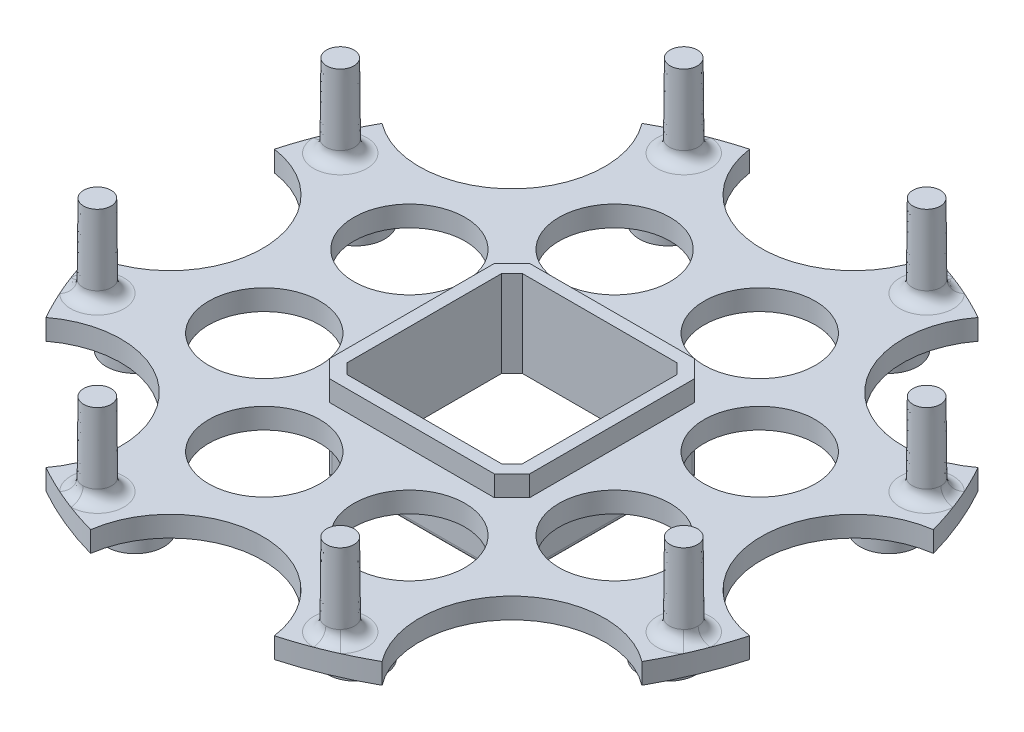
from build123d import *

# Parameters (mm, degrees)
SKETCH1_R                     = 83
BOSS_EXTRUDE1_DEPTH           = 5
SKETCH3_R                     = 3.5
BOSS_EXTRUDE2_DEPTH           = 20
BOSS_EXTRUDE2_DRAFT           = 0.5
BOSS_EXTRUDE2_PROFILE_2_DEPTH = 20
BOSS_EXTRUDE2_PROFILE_2_DRAFT = 0.5
BOSS_EXTRUDE2_PROFILE_3_DEPTH = 20
BOSS_EXTRUDE2_PROFILE_3_DRAFT = 0.5
BOSS_EXTRUDE2_PROFILE_4_DEPTH = 20
BOSS_EXTRUDE2_PROFILE_4_DRAFT = 0.5
BOSS_EXTRUDE2_PROFILE_5_DEPTH = 20
BOSS_EXTRUDE2_PROFILE_5_DRAFT = 0.5
BOSS_EXTRUDE2_PROFILE_6_DEPTH = 20
BOSS_EXTRUDE2_PROFILE_6_DRAFT = 0.5
BOSS_EXTRUDE2_PROFILE_7_DEPTH = 20
BOSS_EXTRUDE2_PROFILE_7_DRAFT = 0.5
BOSS_EXTRUDE2_PROFILE_8_DEPTH = 20
BOSS_EXTRUDE2_PROFILE_8_DRAFT = 0.5
SKETCH4_W                     = 42.5
SKETCH4_H                     = 42.5
CUT_EXTRUDE1_DEPTH            = 121.012499349
SKETCH5_R                     = 22.5
SKETCH5_R_2                   = 13.5
CUT_EXTRUDE2_DEPTH            = 121.012499349
FILLET1_R                     = 3
CHAMFER1_SIZE                 = 2.5
SKETCH7_R                     = 7
SKETCH7_R_2                   = 2.15
BOSS_EXTRUDE3_DEPTH           = 5
EXTRUDE_THIN1_DEPTH           = 11
EXTRUDE_THIN1_DEPTH_BACK      = 10
FILLET3_R                     = 1.25


with BuildPart() as part:
    # Sketch1 → Boss-Extrude1 (new body)
    with BuildSketch(Plane(origin=(0, 0, 0), x_dir=(1, 0, 0), z_dir=(0, 1, 0))):
        with Locations(Location((0, 0, 0), (0, 0, 270))):
            Circle(SKETCH1_R)
    extrude(amount=BOSS_EXTRUDE1_DEPTH)


with BuildPart() as boss_extrude2_tool:
    # Sketch3 → Boss-Extrude2 (with draft: the straight prism first)
    with BuildSketch(Plane(origin=(0, 5, 0), x_dir=(1, 0, 0), z_dir=(0, 1, 0))):
        with Locations((-71.138724003, 29.466624292)):
            Circle(SKETCH3_R)
    extrude(amount=BOSS_EXTRUDE2_DEPTH)
    # Boss-Extrude2: the draft: its side faces are tilted about the plane it starts from
    boss_extrude2_sides = [boss_extrude2_tool.faces().sort_by_distance(p)[0] for p in [
        (-74.638724003, 15, -29.466624292),
    ]]
    draft(boss_extrude2_sides, Plane(origin=(0, 5, 0), x_dir=(1, 0, 0), z_dir=(0, 1, 0)), BOSS_EXTRUDE2_DRAFT)


with BuildPart() as part_1:
    add(part.part)

    # Boss-Extrude2: add boss_extrude2_tool
    add(boss_extrude2_tool.part)


with BuildPart() as boss_extrude2_profile_2_tool:
    # Sketch3 → Boss-Extrude2 profile 2 (with draft: the straight prism first)
    with BuildSketch(Plane(origin=(0, 5, 0), x_dir=(1, 0, 0), z_dir=(0, 1, 0))):
        with Locations((-29.466624292, 71.138724003)):
            Circle(SKETCH3_R)
    extrude(amount=BOSS_EXTRUDE2_PROFILE_2_DEPTH)
    # Boss-Extrude2 profile 2: the draft: its side faces are tilted about the plane it starts from
    boss_extrude2_profile_2_sides = [boss_extrude2_profile_2_tool.faces().sort_by_distance(p)[0] for p in [
        (-32.966624292, 15, -71.138724003),
    ]]
    draft(boss_extrude2_profile_2_sides, Plane(origin=(0, 5, 0), x_dir=(1, 0, 0), z_dir=(0, 1, 0)), BOSS_EXTRUDE2_PROFILE_2_DRAFT)


with BuildPart() as part_2:
    add(part_1.part)

    # Boss-Extrude2 profile 2: add boss_extrude2_profile_2_tool
    add(boss_extrude2_profile_2_tool.part)


with BuildPart() as boss_extrude2_profile_3_tool:
    # Sketch3 → Boss-Extrude2 profile 3 (with draft: the straight prism first)
    with BuildSketch(Plane(origin=(0, 5, 0), x_dir=(1, 0, 0), z_dir=(0, 1, 0))):
        with Locations((29.466624292, 71.138724003)):
            Circle(SKETCH3_R)
    extrude(amount=BOSS_EXTRUDE2_PROFILE_3_DEPTH)
    # Boss-Extrude2 profile 3: the draft: its side faces are tilted about the plane it starts from
    boss_extrude2_profile_3_sides = [boss_extrude2_profile_3_tool.faces().sort_by_distance(p)[0] for p in [
        (25.966624292, 15, -71.138724003),
    ]]
    draft(boss_extrude2_profile_3_sides, Plane(origin=(0, 5, 0), x_dir=(1, 0, 0), z_dir=(0, 1, 0)), BOSS_EXTRUDE2_PROFILE_3_DRAFT)


with BuildPart() as part_3:
    add(part_2.part)

    # Boss-Extrude2 profile 3: add boss_extrude2_profile_3_tool
    add(boss_extrude2_profile_3_tool.part)


with BuildPart() as boss_extrude2_profile_4_tool:
    # Sketch3 → Boss-Extrude2 profile 4 (with draft: the straight prism first)
    with BuildSketch(Plane(origin=(0, 5, 0), x_dir=(1, 0, 0), z_dir=(0, 1, 0))):
        with Locations((71.138724003, 29.466624292)):
            Circle(SKETCH3_R)
    extrude(amount=BOSS_EXTRUDE2_PROFILE_4_DEPTH)
    # Boss-Extrude2 profile 4: the draft: its side faces are tilted about the plane it starts from
    boss_extrude2_profile_4_sides = [boss_extrude2_profile_4_tool.faces().sort_by_distance(p)[0] for p in [
        (67.638724003, 15, -29.466624292),
    ]]
    draft(boss_extrude2_profile_4_sides, Plane(origin=(0, 5, 0), x_dir=(1, 0, 0), z_dir=(0, 1, 0)), BOSS_EXTRUDE2_PROFILE_4_DRAFT)


with BuildPart() as part_4:
    add(part_3.part)

    # Boss-Extrude2 profile 4: add boss_extrude2_profile_4_tool
    add(boss_extrude2_profile_4_tool.part)


with BuildPart() as boss_extrude2_profile_5_tool:
    # Sketch3 → Boss-Extrude2 profile 5 (with draft: the straight prism first)
    with BuildSketch(Plane(origin=(0, 5, 0), x_dir=(1, 0, 0), z_dir=(0, 1, 0))):
        with Locations((71.138724003, -29.466624292)):
            Circle(SKETCH3_R)
    extrude(amount=BOSS_EXTRUDE2_PROFILE_5_DEPTH)
    # Boss-Extrude2 profile 5: the draft: its side faces are tilted about the plane it starts from
    boss_extrude2_profile_5_sides = [boss_extrude2_profile_5_tool.faces().sort_by_distance(p)[0] for p in [
        (67.638724003, 15, 29.466624292),
    ]]
    draft(boss_extrude2_profile_5_sides, Plane(origin=(0, 5, 0), x_dir=(1, 0, 0), z_dir=(0, 1, 0)), BOSS_EXTRUDE2_PROFILE_5_DRAFT)


with BuildPart() as part_5:
    add(part_4.part)

    # Boss-Extrude2 profile 5: add boss_extrude2_profile_5_tool
    add(boss_extrude2_profile_5_tool.part)


with BuildPart() as boss_extrude2_profile_6_tool:
    # Sketch3 → Boss-Extrude2 profile 6 (with draft: the straight prism first)
    with BuildSketch(Plane(origin=(0, 5, 0), x_dir=(1, 0, 0), z_dir=(0, 1, 0))):
        with Locations((29.466624292, -71.138724003)):
            Circle(SKETCH3_R)
    extrude(amount=BOSS_EXTRUDE2_PROFILE_6_DEPTH)
    # Boss-Extrude2 profile 6: the draft: its side faces are tilted about the plane it starts from
    boss_extrude2_profile_6_sides = [boss_extrude2_profile_6_tool.faces().sort_by_distance(p)[0] for p in [
        (25.966624292, 15, 71.138724003),
    ]]
    draft(boss_extrude2_profile_6_sides, Plane(origin=(0, 5, 0), x_dir=(1, 0, 0), z_dir=(0, 1, 0)), BOSS_EXTRUDE2_PROFILE_6_DRAFT)


with BuildPart() as part_6:
    add(part_5.part)

    # Boss-Extrude2 profile 6: add boss_extrude2_profile_6_tool
    add(boss_extrude2_profile_6_tool.part)


with BuildPart() as boss_extrude2_profile_7_tool:
    # Sketch3 → Boss-Extrude2 profile 7 (with draft: the straight prism first)
    with BuildSketch(Plane(origin=(0, 5, 0), x_dir=(1, 0, 0), z_dir=(0, 1, 0))):
        with Locations((-29.466624292, -71.138724003)):
            Circle(SKETCH3_R)
    extrude(amount=BOSS_EXTRUDE2_PROFILE_7_DEPTH)
    # Boss-Extrude2 profile 7: the draft: its side faces are tilted about the plane it starts from
    boss_extrude2_profile_7_sides = [boss_extrude2_profile_7_tool.faces().sort_by_distance(p)[0] for p in [
        (-32.966624292, 15, 71.138724003),
    ]]
    draft(boss_extrude2_profile_7_sides, Plane(origin=(0, 5, 0), x_dir=(1, 0, 0), z_dir=(0, 1, 0)), BOSS_EXTRUDE2_PROFILE_7_DRAFT)


with BuildPart() as part_7:
    add(part_6.part)

    # Boss-Extrude2 profile 7: add boss_extrude2_profile_7_tool
    add(boss_extrude2_profile_7_tool.part)


with BuildPart() as boss_extrude2_profile_8_tool:
    # Sketch3 → Boss-Extrude2 profile 8 (with draft: the straight prism first)
    with BuildSketch(Plane(origin=(0, 5, 0), x_dir=(1, 0, 0), z_dir=(0, 1, 0))):
        with Locations((-71.138724003, -29.466624292)):
            Circle(SKETCH3_R)
    extrude(amount=BOSS_EXTRUDE2_PROFILE_8_DEPTH)
    # Boss-Extrude2 profile 8: the draft: its side faces are tilted about the plane it starts from
    boss_extrude2_profile_8_sides = [boss_extrude2_profile_8_tool.faces().sort_by_distance(p)[0] for p in [
        (-74.638724003, 15, 29.466624292),
    ]]
    draft(boss_extrude2_profile_8_sides, Plane(origin=(0, 5, 0), x_dir=(1, 0, 0), z_dir=(0, 1, 0)), BOSS_EXTRUDE2_PROFILE_8_DRAFT)


with BuildPart() as part_8:
    add(part_7.part)

    # Boss-Extrude2 profile 8: add boss_extrude2_profile_8_tool
    add(boss_extrude2_profile_8_tool.part)

    # Sketch4 → Cut-Extrude1 (cut, through all)
    with BuildSketch(Plane.XZ):
        Rectangle(SKETCH4_W, SKETCH4_H)
    extrude(amount=-CUT_EXTRUDE1_DEPTH, mode=Mode.SUBTRACT)

    # Sketch5 → Cut-Extrude2 (cut, through all)
    with BuildSketch(Plane.XZ):
        with Locations((-83, 0)):
            Circle(SKETCH5_R)
        with Locations((-58.689862838, 58.689862838)):
            Circle(SKETCH5_R)
        with Locations((0, 83)):
            Circle(SKETCH5_R)
        with Locations((58.689862838, 58.689862838)):
            Circle(SKETCH5_R)
        with Locations((83, 0)):
            Circle(SKETCH5_R)
        with Locations((58.689862838, -58.689862838)):
            Circle(SKETCH5_R)
        with Locations((0, -83)):
            Circle(SKETCH5_R)
        with Locations((-58.689862838, -58.689862838)):
            Circle(SKETCH5_R)
        with Locations(Location((17.603437889, 42.498458496, 0), (0, 0, 270))):
            Circle(SKETCH5_R_2)
        with Locations(Location((42.498458496, 17.603437889, 0), (0, 0, 270))):
            Circle(SKETCH5_R_2)
        with Locations(Location((42.498458496, -17.603437889, 0), (0, 0, 270))):
            Circle(SKETCH5_R_2)
        with Locations(Location((17.603437889, -42.498458496, 0), (0, 0, 270))):
            Circle(SKETCH5_R_2)
        with Locations(Location((-17.603437889, -42.498458496, 0), (0, 0, 270))):
            Circle(SKETCH5_R_2)
        with Locations(Location((-42.498458496, -17.603437889, 0), (0, 0, 270))):
            Circle(SKETCH5_R_2)
        with Locations(Location((-42.498458496, 17.603437889, 0), (0, 0, 270))):
            Circle(SKETCH5_R_2)
        with Locations(Location((-17.603437889, 42.498458496, 0), (0, 0, 270))):
            Circle(SKETCH5_R_2)
    extrude(amount=-CUT_EXTRUDE2_DEPTH, mode=Mode.SUBTRACT)

    # Fillet1
    fillet1_edges = [part_8.edges().sort_by_distance(p)[0] for p in [
        (-32.966624292, 5, -71.138724003),
        (-74.638724003, 5, -29.466624292),
        (-74.638724003, 5, 29.466624292),
        (-32.966624292, 5, 71.138724003),
        (25.966624292, 5, 71.138724003),
        (67.638724003, 5, 29.466624292),
        (67.638724003, 5, -29.466624292),
        (25.966624292, 5, -71.138724003),
    ]]
    fillet(fillet1_edges, radius=FILLET1_R)

    # Chamfer1
    chamfer1_edges = [part_8.edges().sort_by_distance(p)[0] for p in [
        (-21.25, 2.5, -21.25),
        (-21.25, 2.5, 21.25),
        (21.25, 2.5, 21.25),
        (21.25, 2.5, -21.25),
    ]]
    chamfer(chamfer1_edges, length=CHAMFER1_SIZE)

    # Sketch7 → Boss-Extrude3 (add)
    # profile 1 of 8: a face of its own
    with BuildSketch(Plane(origin=(0, 0, 0), x_dir=(-1, 0, 0), z_dir=(0, -1, 0))):
        with Locations(Location((-64.671567276, 26.787840266, 0), (0, 0, 270))):
            Circle(SKETCH7_R)
        with Locations(Location((-64.671567276, 26.787840266, 0), (0, 0, 90))):
            Circle(SKETCH7_R_2, mode=Mode.SUBTRACT)
    # profile 2 of 8: a face of its own
    with BuildSketch(Plane(origin=(0, 0, 0), x_dir=(-1, 0, 0), z_dir=(0, -1, 0))):
        with Locations(Location((-26.787840266, -64.671567276, 0), (0, 0, 270))):
            Circle(SKETCH7_R)
        with Locations(Location((-26.787840266, -64.671567276, 0), (0, 0, 90))):
            Circle(SKETCH7_R_2, mode=Mode.SUBTRACT)
    # profile 3 of 8: a face of its own
    with BuildSketch(Plane(origin=(0, 0, 0), x_dir=(-1, 0, 0), z_dir=(0, -1, 0))):
        with Locations(Location((-64.671567276, -26.787840266, 0), (0, 0, 270))):
            Circle(SKETCH7_R)
        with Locations(Location((-64.671567276, -26.787840266, 0), (0, 0, 90))):
            Circle(SKETCH7_R_2, mode=Mode.SUBTRACT)
    # profile 4 of 8: a face of its own
    with BuildSketch(Plane(origin=(0, 0, 0), x_dir=(-1, 0, 0), z_dir=(0, -1, 0))):
        with Locations(Location((26.787840266, -64.671567276, 0), (0, 0, 270))):
            Circle(SKETCH7_R)
        with Locations(Location((26.787840266, -64.671567276, 0), (0, 0, 90))):
            Circle(SKETCH7_R_2, mode=Mode.SUBTRACT)
    # profile 5 of 8: a face of its own
    with BuildSketch(Plane(origin=(0, 0, 0), x_dir=(-1, 0, 0), z_dir=(0, -1, 0))):
        with Locations(Location((64.671567276, -26.787840266, 0), (0, 0, 270))):
            Circle(SKETCH7_R)
        with Locations(Location((64.671567276, -26.787840266, 0), (0, 0, 90))):
            Circle(SKETCH7_R_2, mode=Mode.SUBTRACT)
    # profile 6 of 8: a face of its own
    with BuildSketch(Plane(origin=(0, 0, 0), x_dir=(-1, 0, 0), z_dir=(0, -1, 0))):
        with Locations(Location((64.671567276, 26.787840266, 0), (0, 0, 270))):
            Circle(SKETCH7_R)
        with Locations(Location((64.671567276, 26.787840266, 0), (0, 0, 90))):
            Circle(SKETCH7_R_2, mode=Mode.SUBTRACT)
    # profile 7 of 8: a face of its own
    with BuildSketch(Plane(origin=(0, 0, 0), x_dir=(-1, 0, 0), z_dir=(0, -1, 0))):
        with Locations(Location((26.787840266, 64.671567276, 0), (0, 0, 270))):
            Circle(SKETCH7_R)
        with Locations(Location((26.787840266, 64.671567276, 0), (0, 0, 90))):
            Circle(SKETCH7_R_2, mode=Mode.SUBTRACT)
    # profile 8 of 8: a face of its own
    with BuildSketch(Plane(origin=(0, 0, 0), x_dir=(-1, 0, 0), z_dir=(0, -1, 0))):
        with Locations(Location((-26.787840266, 64.671567276, 0), (0, 0, 270))):
            Circle(SKETCH7_R)
        with Locations(Location((-26.787840266, 64.671567276, 0), (0, 0, 90))):
            Circle(SKETCH7_R_2, mode=Mode.SUBTRACT)
    extrude(amount=BOSS_EXTRUDE3_DEPTH)

    # Sketch8 → Extrude-Thin1 (add, two sides: drawn at the far end of the back side and taken through both)
    with BuildSketch(Plane.XZ.offset(-EXTRUDE_THIN1_DEPTH_BACK)):
        Polygon((-24.25, 19.992640687), (-19.992640687, 24.25), (19.992640687, 24.25), (24.25, 19.992640687), (24.25, -19.992640687), (19.992640687, -24.25), (-19.992640687, -24.25), (-24.25, -19.992640687), align=None)
        Polygon((-21.25, 18.75), (-18.75, 21.25), (18.75, 21.25), (21.25, 18.75), (21.25, -18.75), (18.75, -21.25), (-18.75, -21.25), (-21.25, -18.75), align=None, mode=Mode.SUBTRACT)
    extrude(amount=EXTRUDE_THIN1_DEPTH + EXTRUDE_THIN1_DEPTH_BACK)

    # Fillet3
    fillet3_edges = [part_8.edges().sort_by_distance(p)[0] for p in [
        (19.992640687, -5.5, -24.25),
        (0, 0, -24.25),
        (-19.992640687, -5.5, -24.25),
        (-22.121320344, 0, -22.121320344),
        (-24.25, -5.5, -19.992640687),
        (-24.25, 0, 0),
        (-24.25, -5.5, 19.992640687),
        (-22.121320344, 0, 22.121320344),
        (-19.992640687, -5.5, 24.25),
        (0, 0, 24.25),
        (19.992640687, -5.5, 24.25),
        (22.121320344, 0, 22.121320344),
        (24.25, -5.5, 19.992640687),
        (24.25, 0, 0),
        (24.25, -5.5, -19.992640687),
        (22.121320344, 0, -22.121320344),
        (0, -11, -24.25),
        (24.25, -11, 0),
        (0, -11, 24.25),
        (-24.25, -11, 0),
    ]]
    fillet(fillet3_edges, radius=FILLET3_R)


solid = part_8.part
